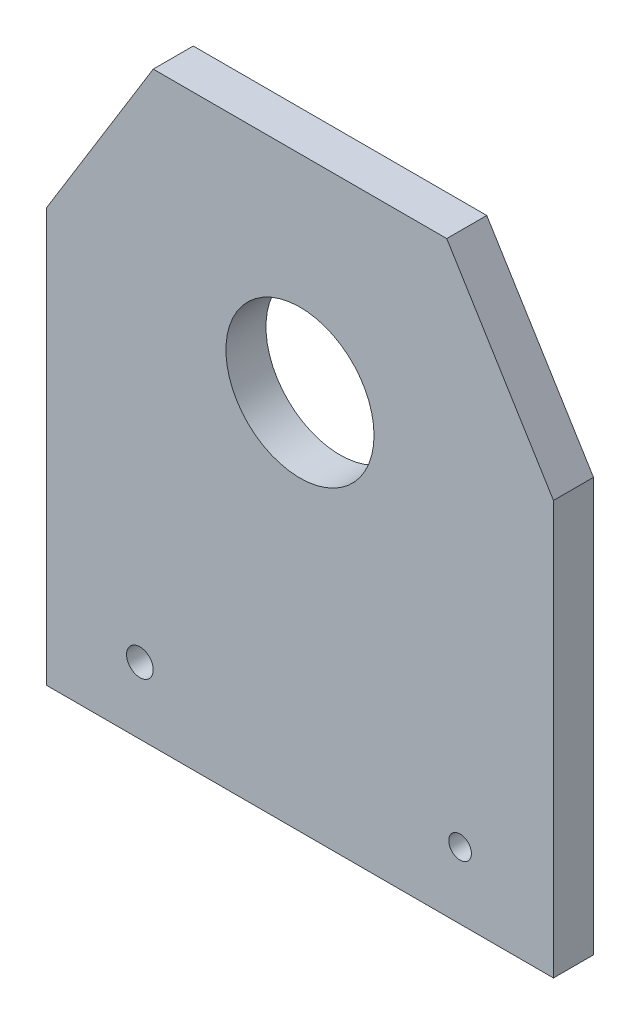
from build123d import *

# Parameters (mm, degrees)
SKETCH_1_R                  = 11.1
SKETCH_1_R_2                = 2
SKETCH_1_R_3                = 1.7
F_08_TILT_IDLER_CHEEK_DEPTH = 6


with BuildPart() as part:
    # Эскиз1 → 08_Tilt_idler_cheek (new body)
    with BuildSketch(Plane.XY):
        Polygon((-38, 0), (38, 0), (38, 62), (22, 88), (-22, 88), (-38, 62), align=None)
        with Locations((0, 57)):
            Circle(SKETCH_1_R, mode=Mode.SUBTRACT)
        with Locations((-24, 10)):
            Circle(SKETCH_1_R_2, mode=Mode.SUBTRACT)
        with Locations((24, 10)):
            Circle(SKETCH_1_R_3, mode=Mode.SUBTRACT)
    extrude(amount=F_08_TILT_IDLER_CHEEK_DEPTH)


solid = part.part
